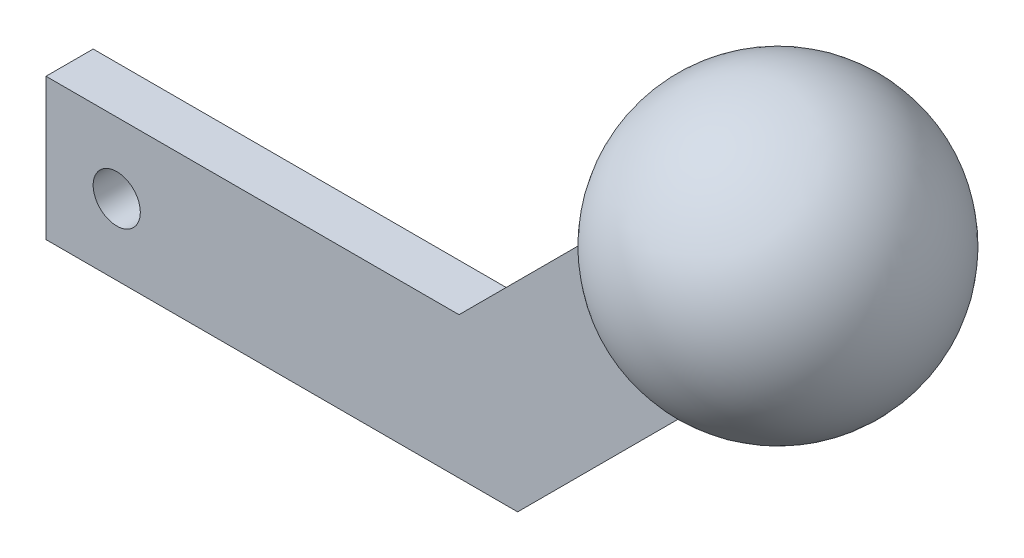
from build123d import *

# Parameters (mm, degrees)
SKETCH1_R           = 2.5
BOSS_EXTRUDE1_DEPTH = 5


with BuildPart() as part:
    # Sketch1 → Boss-Extrude1 (new body)
    with BuildSketch(Plane.XY):
        Polygon((0, 0), (50, 0), (71.213203436, 21.213203436), (60.606601718, 31.819805153), (43.786796564, 15), (0, 15), align=None)
        with Locations((7.5, 7.5)):
            Circle(SKETCH1_R, mode=Mode.SUBTRACT)
    extrude(amount=BOSS_EXTRUDE1_DEPTH)

    # Sketch2 → Revolve2 (revolve)
    with BuildSketch(Plane.XY.offset(2.5)):
        with BuildLine():
            Line((65.909902577, 26.516504294), (85.70209083, 46.308692548))
            ThreePointArc((85.70209083, 46.308692548), (88.085870169, 28.20209083), (71.213203436, 21.213203436))
            Line((71.213203436, 21.213203436), (65.909902577, 26.516504294))
        make_face()
    revolve(axis=Axis((65.909902577, 26.516504294, 2.5), (0.7071067811865461, 0.7071067811865489, 0)))


solid = part.part
